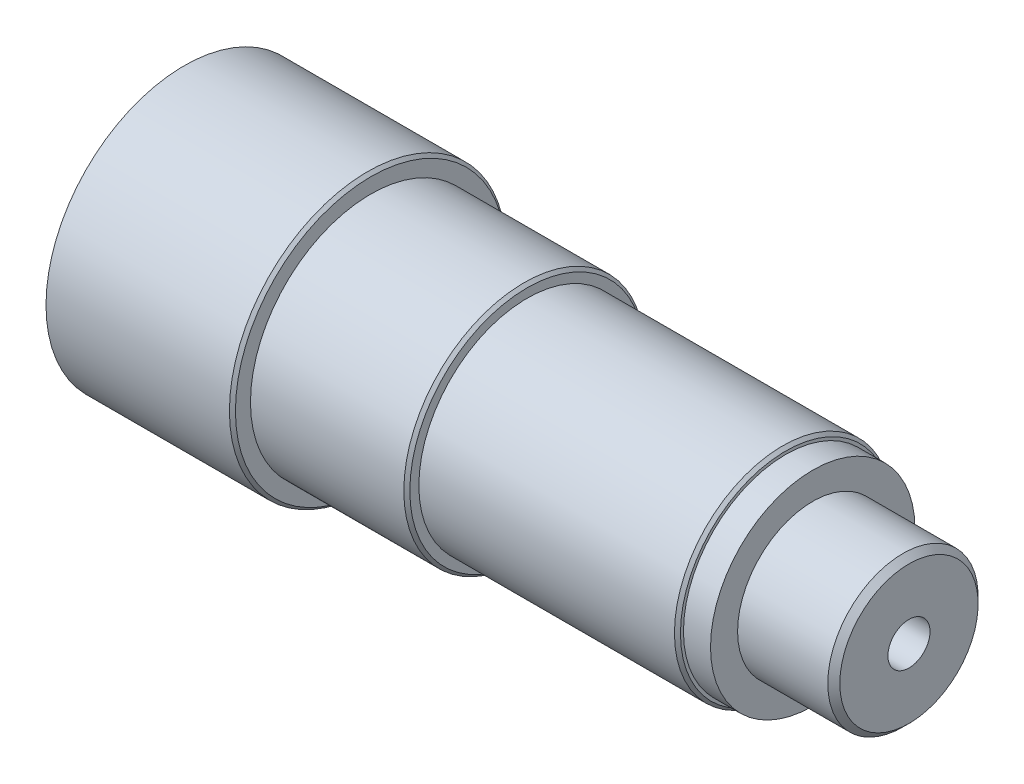
from build123d import *

# Parameters (mm, degrees)
CHANFREIN1_SIZE           = 0.5
CHANFREIN2_SIZE           = 1
TROU_TARAUD_M8X1_01_D     = 7
TROU_TARAUD_M8X1_01_DEPTH = 23
TROU_TARAUD_M8X1_01_TIP   = 2.103012167


with BuildPart() as part:
    # Esquisse1 → Révolution1 (revolve)
    with BuildSketch(Plane.XY, mode=Mode.PRIVATE) as r_volution1_sk:
        Polygon((-44, 23), (-13, 23), (-13, 20), (13, 20), (13, 18), (56, 18), (56, 17), (60.5, 17), (60.5, 12.5), (76.5, 12.5), (76.5, 0), (-44, 0), align=None)
    revolve(r_volution1_sk.sketch.rotate(Axis((-47.210983023, 0, 0), (1, 0, 0)), 90), axis=Axis((-47.210983023, 0, 0), (1, 0, 0)))

    # Chanfrein1
    chanfrein1_edges = [part.edges().sort_by_distance(p)[0] for p in [
        (56, 0, -18),
        (13, 0, -20),
        (-13, 0, -23),
    ]]
    chamfer(chanfrein1_edges, length=CHANFREIN1_SIZE)

    # Chanfrein2
    chanfrein2_edges = [part.edges().sort_by_distance(p)[0] for p in [
        (76.5, 0, -12.5),
    ]]
    chamfer(chanfrein2_edges, length=CHANFREIN2_SIZE)

    # Trou taraudé M8x1.01
    with Locations(Plane(origin=(76.5, 0, 0), x_dir=(0, 0, -1), z_dir=(1, 0, 0))):
        with Locations((0, 0)):
            Hole(TROU_TARAUD_M8X1_01_D / 2, depth=TROU_TARAUD_M8X1_01_DEPTH)
            with Locations((0, 0, -(TROU_TARAUD_M8X1_01_DEPTH + TROU_TARAUD_M8X1_01_TIP / 2))):  # 118° drill point
                Cone(0, TROU_TARAUD_M8X1_01_D / 2, TROU_TARAUD_M8X1_01_TIP, mode=Mode.SUBTRACT)


solid = part.part
